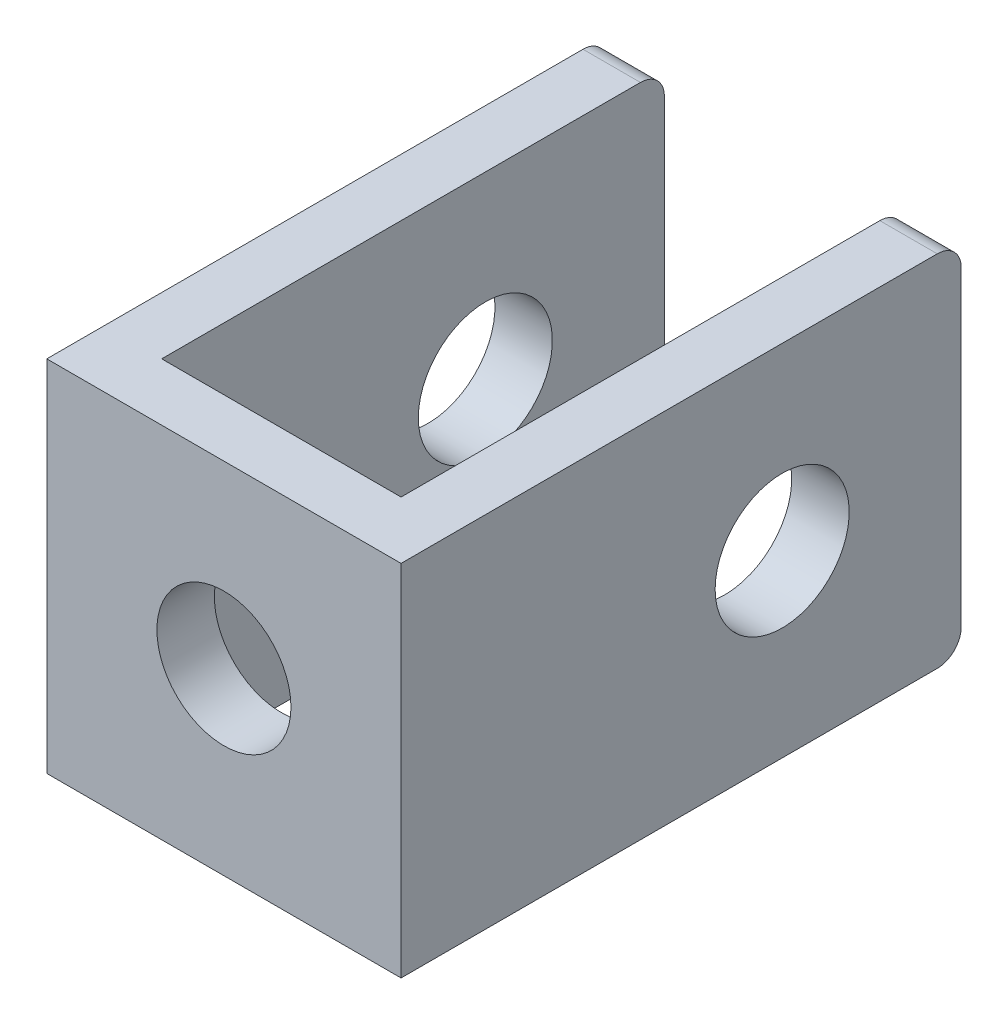
from build123d import *

# Parameters (mm, degrees)
SKETCH1_W                 = 14.859
SKETCH1_H                 = 9.525
BOSS_EXTRUDE1_DEPTH       = 9.398
SKETCH2_W                 = 6.35
SKETCH2_H                 = 13.335
CUT_EXTRUDE1_DEPTH        = 13.961623982
F_5_CLEARANCE_HOLE1_D     = 3.556
F_5_CLEARANCE_HOLE1_DEPTH = 1.524
F_5_CLEARANCE_HOLE2_D     = 3.556
F_5_CLEARANCE_HOLE2_DEPTH = 14.859
F_5_CLEARANCE_HOLE3_D     = 3.556
FILLET1_R                 = 0.635


with BuildPart() as part:
    # Sketch1 → Boss-Extrude1 (new body)
    with BuildSketch(Plane(origin=(4.699, 0, 0), x_dir=(0, 0, -1), z_dir=(1, 0, 0))):
        with Locations((0, 4.7625)):
            Rectangle(SKETCH1_W, SKETCH1_H)
    extrude(amount=-BOSS_EXTRUDE1_DEPTH)

    # Sketch2 → Cut-Extrude1 (cut, through all)
    with BuildSketch(Plane.XZ):
        with Locations((0, -0.762)):
            Rectangle(SKETCH2_W, SKETCH2_H)
    extrude(amount=-CUT_EXTRUDE1_DEPTH, mode=Mode.SUBTRACT)

    # #5 Clearance Hole1
    with Locations(Plane.ZY.offset(4.699)):
        with Locations((-2.6797, 4.7625)):
            Hole(F_5_CLEARANCE_HOLE1_D / 2, depth=F_5_CLEARANCE_HOLE1_DEPTH)

    # #5 Clearance Hole2
    with Locations(Plane.XY.offset(7.4295)):
        with Locations((0, 4.7625)):
            Hole(F_5_CLEARANCE_HOLE2_D / 2, depth=F_5_CLEARANCE_HOLE2_DEPTH)

    # #5 Clearance Hole3 (through all)
    with Locations(Plane.ZY.offset(-3.175)):
        with Locations((-2.6797, 4.7625)):
            Hole(F_5_CLEARANCE_HOLE3_D / 2)

    # Fillet1
    fillet1_edges = [part.edges().sort_by_distance(p)[0] for p in [
        (3.937, 0, -7.4295),
        (3.937, 9.525, -7.4295),
        (-3.937, 9.525, -7.4295),
        (-3.937, 0, -7.4295),
    ]]
    fillet(fillet1_edges, radius=FILLET1_R)


solid = part.part
